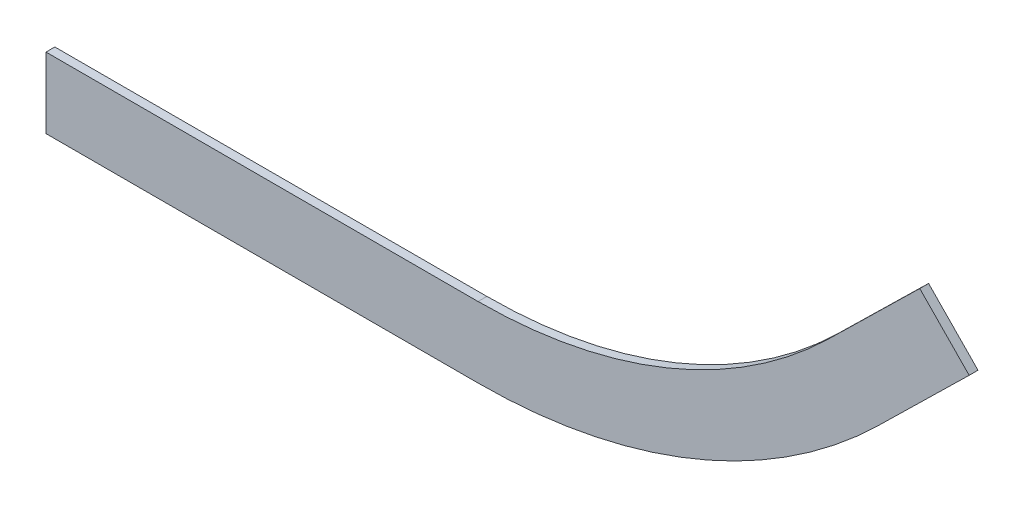
from build123d import *

# Parameters (mm, degrees)
BOSS_EXTRUDE1_DEPTH = 2.5


with BuildPart() as part:
    # Sketch4 → Boss-Extrude1 (new, symmetric)
    with BuildSketch(Plane.XY):
        with BuildLine():
            Line((50, 40), (244.655381072, 40))
            ThreePointArc((244.655381072, 40), (351.936835728, 61.042418845), (443.320675573, 121.051482487))
            Line((443.320675573, 121.051482487), (459.066489093, 136.464981035))
            Line((459.066489093, 136.464981035), (494.796861895, 171.441265278))
            Line((494.796861895, 171.441265278), (522.777889288, 142.856967039))
            Line((522.777889288, 142.856967039), (487.047516486, 107.880682795))
            Line((487.047516486, 107.880682795), (471.305428262, 92.47083092))
            ThreePointArc((471.305428262, 92.47083092), (367.046513526, 24.007086549), (244.650168029, 0))
            Line((244.650168029, 0), (50, 0))
            Line((50, 0), (0, 0))
            Line((0, 0), (0, 40))
            Line((0, 40), (50, 40))
        make_face()
    extrude(amount=BOSS_EXTRUDE1_DEPTH, both=True)


solid = part.part
